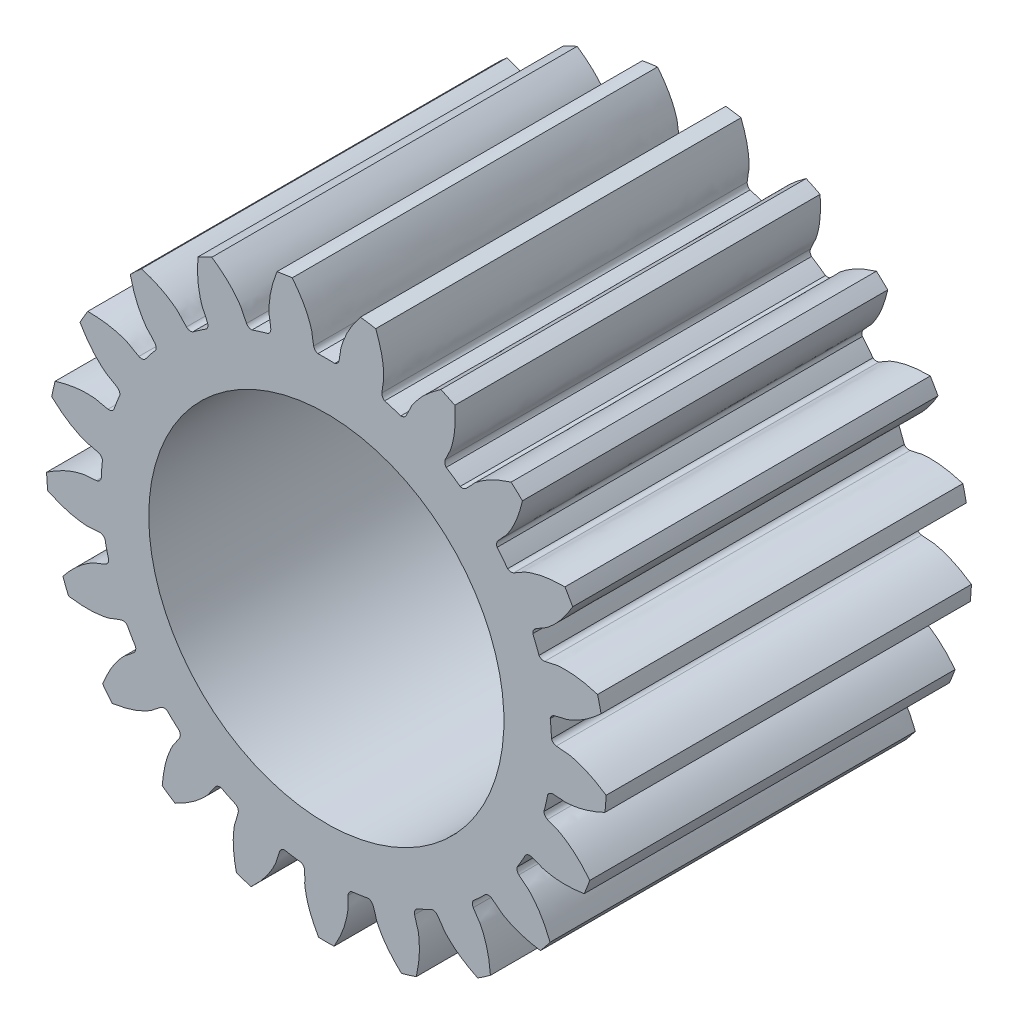
from build123d import *

# Parameters (mm, degrees)
SKETCH1_R           = 5
BOSS_EXTRUDE1_DEPTH = 30
SCALE3_SCALE        = 0.3
CUT_EXTRUDE1_REACH  = 23.803
SKETCH2_R           = 4.375


with BuildPart() as part:
    # Sketch1 → Boss-Extrude1 (new body)
    with BuildSketch(Plane.XY.offset(19)):
        with BuildLine():
            ThreePointArc((6.112642394, 17.460973712), (5.452970732, 17.678096905), (4.785614576, 17.870307583))
            ThreePointArc((4.785614576, 17.870307583), (4.611835493, 18.068046015), (4.562578661, 18.326644974))
            add(Edge.make_bspline(
                [(4.562578661, 18.326644974), (4.606948943, 18.893124246), (4.710583507, 19.158526623), (4.7117997, 19.732750836), (4.672203896, 20.456725928), (4.460194442, 21.510241475), (4.212340039, 22.224496041), (4.054477274, 22.639814797)],
                knots=[0, 0, 0, 0, 0.147600965, 0.232681615, 0.408922665, 0.684332643, 1, 1, 1, 1], degree=3))
            ThreePointArc((4.054477274, 22.639814797), (3.427972122, 22.743109003), (2.798854335, 22.829069504))
            add(Edge.make_bspline(
                [(1.041997343, 18.857287227), (1.166571005, 19.411677785), (1.145769358, 19.695835903), (1.313862755, 20.244907425), (1.565094832, 20.925047267), (2.07821446, 21.86926719), (2.525587616, 22.478733062), (2.798854335, 22.829069504)],
                knots=[0, 0, 0, 0, 0.147600965, 0.232681615, 0.408922665, 0.684332643, 1, 1, 1, 1], degree=3))
            ThreePointArc((1.041997343, 18.857287227), (0.918705477, 18.624695802), (0.694362491, 18.486964616))
            ThreePointArc((0.694362491, 18.486964616), (5e-09, 18.5), (-0.69436248, 18.486964617))
            ThreePointArc((-0.69436248, 18.486964617), (-0.918705473, 18.6246958), (-1.041997343, 18.857287227))
            add(Edge.make_bspline(
                [(-1.041997343, 18.857287227), (-1.166571005, 19.411677785), (-1.145769358, 19.695835903), (-1.313862755, 20.244907425), (-1.565094832, 20.925047267), (-2.07821446, 21.86926719), (-2.525587616, 22.478733062), (-2.798854335, 22.829069504)],
                knots=[0, 0, 0, 0, 0.147600965, 0.232681615, 0.408922665, 0.684332643, 1, 1, 1, 1], degree=3))
            ThreePointArc((-2.798854335, 22.829069504), (-3.427972122, 22.743109003), (-4.054477274, 22.639814797))
            add(Edge.make_bspline(
                [(-4.562578661, 18.326644974), (-4.606948943, 18.893124246), (-4.710583507, 19.158526623), (-4.7117997, 19.732750836), (-4.672203896, 20.456725928), (-4.460194442, 21.510241475), (-4.212340039, 22.224496041), (-4.054477274, 22.639814797)],
                knots=[0, 0, 0, 0, 0.147600965, 0.232681615, 0.408922665, 0.684332643, 1, 1, 1, 1], degree=3))
            ThreePointArc((-4.562578661, 18.326644974), (-4.611835489, 18.068046018), (-4.785614566, 17.870307586))
            ThreePointArc((-4.785614566, 17.870307586), (-5.452970722, 17.678096909), (-6.112642384, 17.460973715))
            ThreePointArc((-6.112642384, 17.460973715), (-6.367615425, 17.526459631), (-6.55398731, 17.712376757))
            add(Edge.make_bspline(
                [(-6.55398731, 17.712376757), (-6.836435999, 18.205418566), (-6.900315587, 18.483083729), (-7.222782738, 18.958215146), (-7.663328017, 19.534086328), (-8.431964888, 20.285112544), (-9.039105729, 20.735636004), (-9.403495453, 20.989861202)],
                knots=[0, 0, 0, 0, 0.147600965, 0.232681615, 0.408922665, 0.684332643, 1, 1, 1, 1], degree=3))
            ThreePointArc((-9.403495453, 20.989861202), (-9.979326, 20.722283962), (-10.547550783, 20.438913192))
            add(Edge.make_bspline(
                [(-9.761749529, 16.167599889), (-9.97112126, 16.695833706), (-10.148380355, 16.918898177), (-10.318798074, 17.46725274), (-10.494356805, 18.170734718), (-10.602295495, 19.239936409), (-10.575982797, 19.995515016), (-10.547550783, 20.438913192)],
                knots=[0, 0, 0, 0, 0.147600965, 0.232681615, 0.408922665, 0.684332643, 1, 1, 1, 1], degree=3))
            ThreePointArc((-9.761749529, 16.167599889), (-9.732594634, 15.905971054), (-9.840368768, 15.665795304))
            ThreePointArc((-9.840368768, 15.665795304), (-10.42142107, 15.285417328), (-10.987787186, 14.883498673))
            ThreePointArc((-10.987787186, 14.883498673), (-11.250734803, 14.87092061), (-11.483626743, 14.993643882))
            add(Edge.make_bspline(
                [(-11.483626743, 14.993643882), (-11.898853654, 15.381528014), (-12.041738494, 15.628028454), (-12.489926778, 15.987002254), (-13.080640877, 16.407436094), (-14.036498232, 16.898536628), (-14.74945963, 17.15008669), (-15.172594734, 17.285611619)],
                knots=[0, 0, 0, 0, 0.147600965, 0.232681615, 0.408922665, 0.684332643, 1, 1, 1, 1], degree=3))
            ThreePointArc((-15.172594734, 17.285611619), (-15.643972969, 16.860193052), (-16.103428119, 16.421924456))
            add(Edge.make_bspline(
                [(-14.093546112, 12.571992604), (-14.449315695, 13.015045074), (-14.684449073, 13.17595138), (-15.008925956, 13.649712584), (-15.384040058, 14.270193987), (-15.802336066, 15.260078559), (-15.999903071, 15.989844733), (-16.103428119, 16.421924456)],
                knots=[0, 0, 0, 0, 0.147600965, 0.232681615, 0.408922665, 0.684332643, 1, 1, 1, 1], degree=3))
            ThreePointArc((-14.093546112, 12.571992604), (-13.988570034, 12.330580761), (-14.020763021, 12.069308361))
            ThreePointArc((-14.020763021, 12.069308361), (-14.463882422, 11.534561339), (-14.886618878, 10.983559459))
            ThreePointArc((-14.886618878, 10.983559459), (-15.134177021, 10.894035033), (-15.392895545, 10.94265995))
            add(Edge.make_bspline(
                [(-15.392895545, 10.94265995), (-15.904005944, 11.190921198), (-16.113200092, 11.384354269), (-16.647286013, 11.595274054), (-17.335681392, 11.822913161), (-18.39382711, 12.010451575), (-19.149259316, 12.040676912), (-19.593542388, 12.045459588)],
                knots=[0, 0, 0, 0, 0.147600965, 0.232681615, 0.408922665, 0.684332643, 1, 1, 1, 1], degree=3))
            ThreePointArc((-19.593542388, 12.045459588), (-19.918584287, 11.5), (-20.228445197, 10.945775665))
            add(Edge.make_bspline(
                [(-17.173069274, 7.859308605), (-17.643625021, 8.177812571), (-17.915740049, 8.262263482), (-18.365444901, 8.619335565), (-18.906783841, 9.101683897), (-19.59826973, 9.924295762), (-20.002161743, 10.563406575), (-20.228445197, 10.945775665)],
                knots=[0, 0, 0, 0, 0.147600965, 0.232681615, 0.408922665, 0.684332643, 1, 1, 1, 1], degree=3))
            ThreePointArc((-17.173069274, 7.859308605), (-17.001599599, 7.659564254), (-16.95535095, 7.400410405))
            ThreePointArc((-16.95535095, 7.400410405), (-17.221164348, 6.758808956), (-17.462709154, 6.107682785))
            ThreePointArc((-17.462709154, 6.107682785), (-17.672881196, 5.949166635), (-17.934438027, 5.91937266))
            add(Edge.make_bspline(
                [(-17.934438027, 5.91937266), (-18.496017513, 6.005951923), (-18.75293315, 6.129130247), (-19.32546083, 6.173254869), (-20.050370539, 6.18787251), (-21.116783729, 6.055185193), (-21.847563277, 5.861400151), (-22.273517817, 5.735015611)],
                knots=[0, 0, 0, 0, 0.147600965, 0.232681615, 0.408922665, 0.684332643, 1, 1, 1, 1], degree=3))
            ThreePointArc((-22.273517817, 5.735015611), (-22.42334198, 5.117981481), (-22.556076149, 4.497046671))
            add(Edge.make_bspline(
                [(-18.726689869, 2.448290546), (-19.270220836, 2.613945533), (-19.5551389, 2.614437214), (-20.090113471, 2.823092754), (-20.749576908, 3.12444925), (-21.652811123, 3.706695735), (-22.227140566, 4.198363387), (-22.556076149, 4.497046671)],
                knots=[0, 0, 0, 0, 0.147600965, 0.232681615, 0.408922665, 0.684332643, 1, 1, 1, 1], degree=3))
            ThreePointArc((-18.726689869, 2.448290546), (-18.503962429, 2.307961851), (-18.38338154, 2.073953509))
            ThreePointArc((-18.38338154, 2.073953509), (-18.448270247, 1.382506737), (-18.487161087, 0.689111694))
            ThreePointArc((-18.487161087, 0.689111694), (-18.641272319, 0.475688674), (-18.882426986, 0.370123133))
            add(Edge.make_bspline(
                [(-18.882426986, 0.370123133), (-19.444576757, 0.287327462), (-19.726385802, 0.329306106), (-20.286483644, 0.202714899), (-20.983496274, 0.003012231), (-21.963421445, -0.438110967), (-22.604615364, -0.838687736), (-22.974393442, -1.08500967)],
                knots=[0, 0, 0, 0, 0.147600965, 0.232681615, 0.408922665, 0.684332643, 1, 1, 1, 1], degree=3))
            ThreePointArc((-22.974393442, -1.08500967), (-22.935687335, -1.718792152), (-22.879500749, -2.351264654))
            add(Edge.make_bspline(
                [(-18.616361888, -3.180268872), (-19.184572964, -3.182182037), (-19.456977843, -3.265693272), (-20.029687295, -3.223994236), (-20.748679008, -3.130406424), (-21.783405225, -2.840260476), (-22.477140408, -2.539722813), (-22.879500749, -2.351264654)],
                knots=[0, 0, 0, 0, 0.147600965, 0.232681615, 0.408922665, 0.684332643, 1, 1, 1, 1], degree=3))
            ThreePointArc((-18.616361888, -3.180268872), (-18.362166994, -3.248713092), (-18.177968006, -3.436783259))
            ThreePointArc((-18.177968006, -3.436783259), (-18.036166377, -4.116637273), (-17.868947629, -4.790689996))
            ThreePointArc((-17.868947629, -4.790689996), (-17.953304592, -5.040056312), (-18.152629444, -5.212013459))
            add(Edge.make_bspline(
                [(-18.152629444, -5.212013459), (-18.665400025, -5.456827304), (-18.947062508, -5.499778328), (-19.444963361, -5.78583718), (-20.05214628, -6.182115698), (-20.85851278, -6.892479045), (-21.353148177, -7.464254537), (-21.633893388, -7.808627081)],
                knots=[0, 0, 0, 0, 0.147600965, 0.232681615, 0.408922665, 0.684332643, 1, 1, 1, 1], degree=3))
            ThreePointArc((-21.633893388, -7.808627081), (-21.410096219, -8.40284356), (-21.169981303, -8.990655796))
            add(Edge.make_bspline(
                [(-16.851888457, -8.526247444), (-17.394291594, -8.695558767), (-17.629978919, -8.855652581), (-18.189535505, -8.98461519), (-18.904169925, -9.107111749), (-19.978448179, -9.134847078), (-20.729947685, -9.052143496), (-21.169981303, -8.990655796)],
                knots=[0, 0, 0, 0, 0.147600965, 0.232681615, 0.408922665, 0.684332643, 1, 1, 1, 1], degree=3))
            ThreePointArc((-16.851888457, -8.526247444), (-16.588812441, -8.516725619), (-16.357362242, -8.642146752))
            ThreePointArc((-16.357362242, -8.642146752), (-16.021469973, -9.249999995), (-15.662999757, -9.844817856))
            ThreePointArc((-15.662999757, -9.844817856), (-15.670106965, -10.107970178), (-15.809891114, -10.331039783))
            add(Edge.make_bspline(
                [(-15.809891114, -10.331039783), (-16.22772059, -10.716119018), (-16.484209562, -10.840183322), (-16.87567275, -11.260292235), (-17.339075092, -11.817935518), (-17.900233719, -12.734420112), (-18.204360068, -13.426589566), (-18.371126968, -13.838413708)],
                knots=[0, 0, 0, 0, 0.147600965, 0.232681615, 0.408922665, 0.684332643, 1, 1, 1, 1], degree=3))
            ThreePointArc((-18.371126968, -13.838413708), (-17.982124097, -14.340265443), (-17.579416114, -14.831187716))
            add(Edge.make_bspline(
                [(-13.590050783, -13.114631514), (-14.058451082, -13.436296942), (-14.236479001, -13.658748295), (-14.733163661, -13.946913656), (-15.379942384, -14.27461023), (-16.398318338, -14.61776243), (-17.140808138, -14.760241504), (-17.579416114, -14.831187716)],
                knots=[0, 0, 0, 0, 0.147600965, 0.232681615, 0.408922665, 0.684332643, 1, 1, 1, 1], degree=3))
            ThreePointArc((-13.590050783, -13.114631514), (-13.341469104, -13.027989701), (-13.08333306, -13.07961758))
            ThreePointArc((-13.08333306, -13.07961758), (-12.583195653, -13.561459625), (-12.065325621, -14.024190446))
            ThreePointArc((-12.065325621, -14.024190446), (-11.994551566, -14.277746535), (-12.062374578, -14.532107885))
            add(Edge.make_bspline(
                [(-12.062374578, -14.532107885), (-12.348136965, -15.02323653), (-12.556662256, -15.217390457), (-12.806904558, -15.73422091), (-13.085350991, -16.403679904), (-13.351440338, -17.444852068), (-13.438034679, -18.195913191), (-13.476005296, -18.638596548)],
                knots=[0, 0, 0, 0, 0.147600965, 0.232681615, 0.408922665, 0.684332643, 1, 1, 1, 1], degree=3))
            ThreePointArc((-13.476005296, -18.638596548), (-12.956361336, -19.003491809), (-12.426842659, -19.353903522))
            add(Edge.make_bspline(
                [(-9.120677458, -16.537723022), (-9.473455497, -16.983161169), (-9.578005448, -17.248204283), (-9.96768557, -17.669967639), (-10.489139469, -18.173746949), (-11.36112595, -18.801825442), (-12.028632567, -19.15682728), (-12.426842659, -19.353903522)],
                knots=[0, 0, 0, 0, 0.147600965, 0.232681615, 0.408922665, 0.684332643, 1, 1, 1, 1], degree=3))
            ThreePointArc((-9.120677458, -16.537723022), (-8.908677688, -16.381659725), (-8.64679232, -16.354906988))
            ThreePointArc((-8.64679232, -16.354906988), (-8.026849178, -16.667924054), (-7.395594355, -16.957452171))
            ThreePointArc((-7.395594355, -16.957452171), (-7.253227624, -17.178882456), (-7.243063126, -17.441934428))
            add(Edge.make_bspline(
                [(-7.243063126, -17.441934428), (-7.371367183, -17.995473547), (-7.513400405, -18.242465669), (-7.600186693, -18.810095008), (-7.66893603, -19.531885345), (-7.616312891, -20.605232363), (-7.477680936, -21.348450077), (-7.383481415, -21.78265829)],
                knots=[0, 0, 0, 0, 0.147600965, 0.232681615, 0.408922665, 0.684332643, 1, 1, 1, 1], degree=3))
            ThreePointArc((-7.383481415, -21.78265829), (-6.779369011, -21.978174533), (-6.170089698, -22.156940067))
            add(Edge.make_bspline(
                [(-3.840891915, -18.491365264), (-4.046701818, -19.020996996), (-4.068484078, -19.305081627), (-4.316534874, -19.822967454), (-4.666330481, -20.458066497), (-5.314447663, -21.315263752), (-5.847660206, -21.851244884), (-6.170089698, -22.156940067)],
                knots=[0, 0, 0, 0, 0.147600965, 0.232681615, 0.408922665, 0.684332643, 1, 1, 1, 1], degree=3))
            ThreePointArc((-3.840891915, -18.491365264), (-3.684311165, -18.279747392), (-3.441946137, -18.176991137))
            ThreePointArc((-3.441946137, -18.176991137), (-2.757281929, -18.293370284), (-2.068732076, -18.383969854))
            ThreePointArc((-2.068732076, -18.383969854), (-1.867422577, -18.553599282), (-1.780173729, -18.801968555))
            add(Edge.make_bspline(
                [(-1.780173729, -18.801968555), (-1.739619077, -19.368733769), (-1.802539957, -19.646617751), (-1.718158888, -20.214609618), (-1.571102448, -20.924597058), (-1.20444262, -21.934747337), (-0.852902427, -22.604083488), (-0.634902809, -22.991235252)],
                knots=[0, 0, 0, 0, 0.147600965, 0.232681615, 0.408922665, 0.684332643, 1, 1, 1, 1], degree=3))
            ThreePointArc((-0.634902809, -22.991235252), (0, -23), (0.634902809, -22.991235252))
            add(Edge.make_bspline(
                [(1.780173729, -18.801968555), (1.739619077, -19.368733769), (1.802539957, -19.646617751), (1.718158888, -20.214609618), (1.571102448, -20.924597058), (1.20444262, -21.934747337), (0.852902427, -22.604083488), (0.634902809, -22.991235252)],
                knots=[0, 0, 0, 0, 0.147600965, 0.232681615, 0.408922665, 0.684332643, 1, 1, 1, 1], degree=3))
            ThreePointArc((1.780173729, -18.801968555), (1.867422573, -18.553599285), (2.068732066, -18.383969855))
            ThreePointArc((2.068732066, -18.383969855), (2.757281919, -18.293370286), (3.441946126, -18.176991139))
            ThreePointArc((3.441946126, -18.176991139), (3.68431116, -18.279747391), (3.840891915, -18.491365264))
            add(Edge.make_bspline(
                [(3.840891915, -18.491365264), (4.046701818, -19.020996996), (4.068484078, -19.305081627), (4.316534874, -19.822967454), (4.666330481, -20.458066497), (5.314447663, -21.315263752), (5.847660206, -21.851244884), (6.170089698, -22.156940067)],
                knots=[0, 0, 0, 0, 0.147600965, 0.232681615, 0.408922665, 0.684332643, 1, 1, 1, 1], degree=3))
            ThreePointArc((6.170089698, -22.156940067), (6.779369011, -21.978174533), (7.383481415, -21.78265829))
            add(Edge.make_bspline(
                [(7.243063126, -17.441934428), (7.371367183, -17.995473547), (7.513400405, -18.242465669), (7.600186693, -18.810095008), (7.66893603, -19.531885345), (7.616312891, -20.605232363), (7.477680936, -21.348450077), (7.383481415, -21.78265829)],
                knots=[0, 0, 0, 0, 0.147600965, 0.232681615, 0.408922665, 0.684332643, 1, 1, 1, 1], degree=3))
            ThreePointArc((7.243063126, -17.441934428), (7.253227621, -17.17888246), (7.395594345, -16.957452175))
            ThreePointArc((7.395594345, -16.957452175), (8.026849169, -16.667924058), (8.646792311, -16.354906993))
            ThreePointArc((8.646792311, -16.354906993), (8.908677683, -16.381659725), (9.120677458, -16.537723022))
            add(Edge.make_bspline(
                [(9.120677458, -16.537723022), (9.473455497, -16.983161169), (9.578005448, -17.248204283), (9.96768557, -17.669967639), (10.489139469, -18.173746949), (11.36112595, -18.801825442), (12.028632567, -19.15682728), (12.426842659, -19.353903522)],
                knots=[0, 0, 0, 0, 0.147600965, 0.232681615, 0.408922665, 0.684332643, 1, 1, 1, 1], degree=3))
            ThreePointArc((12.426842659, -19.353903522), (12.956361336, -19.003491809), (13.476005296, -18.638596548))
            add(Edge.make_bspline(
                [(12.062374578, -14.532107885), (12.348136965, -15.02323653), (12.556662256, -15.217390457), (12.806904558, -15.73422091), (13.085350991, -16.403679904), (13.351440338, -17.444852068), (13.438034679, -18.195913191), (13.476005296, -18.638596548)],
                knots=[0, 0, 0, 0, 0.147600965, 0.232681615, 0.408922665, 0.684332643, 1, 1, 1, 1], degree=3))
            ThreePointArc((12.062374578, -14.532107885), (11.994551564, -14.27774654), (12.065325613, -14.024190453))
            ThreePointArc((12.065325613, -14.024190453), (12.583195645, -13.561459632), (13.083333053, -13.079617588))
            ThreePointArc((13.083333053, -13.079617588), (13.341469099, -13.027989702), (13.590050783, -13.114631514))
            add(Edge.make_bspline(
                [(13.590050783, -13.114631514), (14.058451082, -13.436296942), (14.236479001, -13.658748295), (14.733163661, -13.946913656), (15.379942384, -14.27461023), (16.398318338, -14.61776243), (17.140808138, -14.760241504), (17.579416114, -14.831187716)],
                knots=[0, 0, 0, 0, 0.147600965, 0.232681615, 0.408922665, 0.684332643, 1, 1, 1, 1], degree=3))
            ThreePointArc((17.579416114, -14.831187716), (17.982124097, -14.340265443), (18.371126968, -13.838413708))
            add(Edge.make_bspline(
                [(15.809891114, -10.331039783), (16.22772059, -10.716119018), (16.484209562, -10.840183322), (16.87567275, -11.260292235), (17.339075092, -11.817935518), (17.900233719, -12.734420112), (18.204360068, -13.426589566), (18.371126968, -13.838413708)],
                knots=[0, 0, 0, 0, 0.147600965, 0.232681615, 0.408922665, 0.684332643, 1, 1, 1, 1], degree=3))
            ThreePointArc((15.809891114, -10.331039783), (15.670106964, -10.107970183), (15.662999751, -9.844817865))
            ThreePointArc((15.662999751, -9.844817865), (16.021469967, -9.250000005), (16.357362237, -8.642146761))
            ThreePointArc((16.357362237, -8.642146761), (16.588812437, -8.516725622), (16.851888457, -8.526247444))
            add(Edge.make_bspline(
                [(16.851888457, -8.526247444), (17.394291594, -8.695558767), (17.629978919, -8.855652581), (18.189535505, -8.98461519), (18.904169925, -9.107111749), (19.978448179, -9.134847078), (20.729947685, -9.052143496), (21.169981303, -8.990655796)],
                knots=[0, 0, 0, 0, 0.147600965, 0.232681615, 0.408922665, 0.684332643, 1, 1, 1, 1], degree=3))
            ThreePointArc((21.169981303, -8.990655796), (21.410096219, -8.40284356), (21.633893388, -7.808627081))
            add(Edge.make_bspline(
                [(18.152629444, -5.212013459), (18.665400025, -5.456827304), (18.947062508, -5.499778328), (19.444963361, -5.78583718), (20.05214628, -6.182115698), (20.85851278, -6.892479045), (21.353148177, -7.464254537), (21.633893388, -7.808627081)],
                knots=[0, 0, 0, 0, 0.147600965, 0.232681615, 0.408922665, 0.684332643, 1, 1, 1, 1], degree=3))
            ThreePointArc((18.152629444, -5.212013459), (17.953304593, -5.040056317), (17.868947626, -4.790690006))
            ThreePointArc((17.868947626, -4.790690006), (18.036166374, -4.116637283), (18.177968004, -3.436783269))
            ThreePointArc((18.177968004, -3.436783269), (18.362166992, -3.248713096), (18.616361888, -3.180268872))
            add(Edge.make_bspline(
                [(18.616361888, -3.180268872), (19.184572964, -3.182182037), (19.456977843, -3.265693272), (20.029687295, -3.223994236), (20.748679008, -3.130406424), (21.783405225, -2.840260476), (22.477140408, -2.539722813), (22.879500749, -2.351264654)],
                knots=[0, 0, 0, 0, 0.147600965, 0.232681615, 0.408922665, 0.684332643, 1, 1, 1, 1], degree=3))
            ThreePointArc((22.879500749, -2.351264654), (22.935687335, -1.718792152), (22.974393442, -1.08500967))
            add(Edge.make_bspline(
                [(18.882426986, 0.370123133), (19.444576757, 0.287327462), (19.726385802, 0.329306106), (20.286483644, 0.202714899), (20.983496274, 0.003012231), (21.963421445, -0.438110967), (22.604615364, -0.838687736), (22.974393442, -1.08500967)],
                knots=[0, 0, 0, 0, 0.147600965, 0.232681615, 0.408922665, 0.684332643, 1, 1, 1, 1], degree=3))
            ThreePointArc((18.882426986, 0.370123133), (18.641272322, 0.47568867), (18.487161088, 0.689111683))
            ThreePointArc((18.487161088, 0.689111683), (18.448270248, 1.382506726), (18.383381541, 2.073953498))
            ThreePointArc((18.383381541, 2.073953498), (18.503962428, 2.307961846), (18.726689869, 2.448290546))
            add(Edge.make_bspline(
                [(18.726689869, 2.448290546), (19.270220836, 2.613945533), (19.5551389, 2.614437214), (20.090113471, 2.823092754), (20.749576908, 3.12444925), (21.652811123, 3.706695735), (22.227140566, 4.198363387), (22.556076149, 4.497046671)],
                knots=[0, 0, 0, 0, 0.147600965, 0.232681615, 0.408922665, 0.684332643, 1, 1, 1, 1], degree=3))
            ThreePointArc((22.556076149, 4.497046671), (22.42334198, 5.117981481), (22.273517817, 5.735015611))
            add(Edge.make_bspline(
                [(17.934438027, 5.91937266), (18.496017513, 6.005951923), (18.75293315, 6.129130247), (19.32546083, 6.173254869), (20.050370539, 6.18787251), (21.116783729, 6.055185193), (21.847563277, 5.861400151), (22.273517817, 5.735015611)],
                knots=[0, 0, 0, 0, 0.147600965, 0.232681615, 0.408922665, 0.684332643, 1, 1, 1, 1], degree=3))
            ThreePointArc((17.934438027, 5.91937266), (17.672881199, 5.949166632), (17.462709157, 6.107682776))
            ThreePointArc((17.462709157, 6.107682776), (17.221164352, 6.758808946), (16.955350954, 7.400410396))
            ThreePointArc((16.955350954, 7.400410396), (17.001599599, 7.659564249), (17.173069274, 7.859308605))
            add(Edge.make_bspline(
                [(17.173069274, 7.859308605), (17.643625021, 8.177812571), (17.915740049, 8.262263482), (18.365444901, 8.619335565), (18.906783841, 9.101683897), (19.59826973, 9.924295762), (20.002161743, 10.563406575), (20.228445197, 10.945775665)],
                knots=[0, 0, 0, 0, 0.147600965, 0.232681615, 0.408922665, 0.684332643, 1, 1, 1, 1], degree=3))
            ThreePointArc((20.228445197, 10.945775665), (19.918584287, 11.5), (19.593542388, 12.045459588))
            add(Edge.make_bspline(
                [(15.392895545, 10.94265995), (15.904005944, 11.190921198), (16.113200092, 11.384354269), (16.647286013, 11.595274054), (17.335681392, 11.822913161), (18.39382711, 12.010451575), (19.149259316, 12.040676912), (19.593542388, 12.045459588)],
                knots=[0, 0, 0, 0, 0.147600965, 0.232681615, 0.408922665, 0.684332643, 1, 1, 1, 1], degree=3))
            ThreePointArc((15.392895545, 10.94265995), (15.134177026, 10.89403503), (14.886618884, 10.98355945))
            ThreePointArc((14.886618884, 10.98355945), (14.463882429, 11.53456133), (14.020763027, 12.069308353))
            ThreePointArc((14.020763027, 12.069308353), (13.988570035, 12.330580756), (14.093546112, 12.571992604))
            add(Edge.make_bspline(
                [(14.093546112, 12.571992604), (14.449315695, 13.015045074), (14.684449073, 13.17595138), (15.008925956, 13.649712584), (15.384040058, 14.270193987), (15.802336066, 15.260078559), (15.999903071, 15.989844733), (16.103428119, 16.421924456)],
                knots=[0, 0, 0, 0, 0.147600965, 0.232681615, 0.408922665, 0.684332643, 1, 1, 1, 1], degree=3))
            ThreePointArc((16.103428119, 16.421924456), (15.643972969, 16.860193052), (15.172594734, 17.285611619))
            add(Edge.make_bspline(
                [(11.483626743, 14.993643882), (11.898853654, 15.381528014), (12.041738494, 15.628028454), (12.489926778, 15.987002254), (13.080640877, 16.407436094), (14.036498232, 16.898536628), (14.74945963, 17.15008669), (15.172594734, 17.285611619)],
                knots=[0, 0, 0, 0, 0.147600965, 0.232681615, 0.408922665, 0.684332643, 1, 1, 1, 1], degree=3))
            ThreePointArc((11.483626743, 14.993643882), (11.250734808, 14.870920609), (10.987787195, 14.883498667))
            ThreePointArc((10.987787195, 14.883498667), (10.421421079, 15.285417322), (9.840368777, 15.665795299))
            ThreePointArc((9.840368777, 15.665795299), (9.732594636, 15.90597105), (9.761749529, 16.167599889))
            add(Edge.make_bspline(
                [(9.761749529, 16.167599889), (9.97112126, 16.695833706), (10.148380355, 16.918898177), (10.318798074, 17.46725274), (10.494356805, 18.170734718), (10.602295495, 19.239936409), (10.575982797, 19.995515016), (10.547550783, 20.438913192)],
                knots=[0, 0, 0, 0, 0.147600965, 0.232681615, 0.408922665, 0.684332643, 1, 1, 1, 1], degree=3))
            ThreePointArc((10.547550783, 20.438913192), (9.979326, 20.722283962), (9.403495453, 20.989861202))
            add(Edge.make_bspline(
                [(6.55398731, 17.712376757), (6.836435999, 18.205418566), (6.900315587, 18.483083729), (7.222782738, 18.958215146), (7.663328017, 19.534086328), (8.431964888, 20.285112544), (9.039105729, 20.735636004), (9.403495453, 20.989861202)],
                knots=[0, 0, 0, 0, 0.147600965, 0.232681615, 0.408922665, 0.684332643, 1, 1, 1, 1], degree=3))
            ThreePointArc((6.55398731, 17.712376757), (6.36761543, 17.526459632), (6.112642394, 17.460973712))
        make_face()
        with Locations(Location((0, 0, 0), (0, 0, 180))):
            Circle(SKETCH1_R, mode=Mode.SUBTRACT)
    extrude(amount=-BOSS_EXTRUDE1_DEPTH)


with BuildPart() as part_1:
    # Scale3: scaled about (9.15e-07, 0, 4)
    add(part.part.scale(SCALE3_SCALE).moved(Location((6.4e-07, 0, 2.8))))

    # Sketch2 → Cut-Extrude1 (cut, up to next)
    with BuildSketch(Plane.XY.offset(19), mode=Mode.PRIVATE) as cut_extrude1_sk1:
        with Locations(Location((0, 0, 0), (0, 0, 180))):
            Circle(SKETCH2_R)
    cut_extrude1_tool1 = extrude(cut_extrude1_sk1.sketch, amount=-CUT_EXTRUDE1_REACH, mode=Mode.PRIVATE) & part_1.part
    add(cut_extrude1_tool1.solids().sort_by_distance((0, 0, 19))[0], mode=Mode.SUBTRACT)


solid = part_1.part
